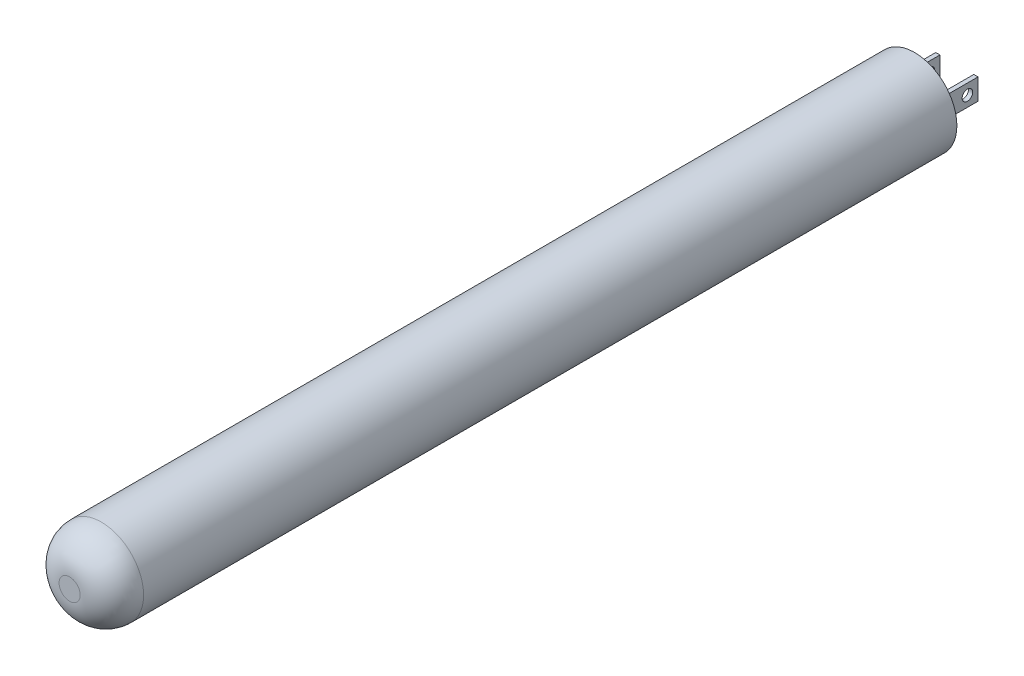
from build123d import *

# Parameters (mm, degrees)
SKETCH1_R           = 20
BOSS_EXTRUDE1_DEPTH = 200
FILLET2_R           = 15
BOSS_EXTRUDE2_START = -200
SKETCH2_W           = 2
SKETCH2_H           = 10
BOSS_EXTRUDE2_DEPTH = 20
SKETCH3_R           = 2.5
CUT_EXTRUDE1_DEPTH  = 11


with BuildPart() as part:
    # Sketch1 → Boss-Extrude1 (new, symmetric)
    with BuildSketch(Plane.XY):
        Circle(SKETCH1_R)
    extrude(amount=BOSS_EXTRUDE1_DEPTH, both=True)

    # Fillet2
    fillet2_edges = [part.edges().sort_by_distance(p)[0] for p in [
        (-20, 0, 200),
    ]]
    fillet(fillet2_edges, radius=FILLET2_R)

    # Sketch2 → Boss-Extrude2 (add)
    with BuildSketch(Plane.XY.offset(BOSS_EXTRUDE2_START)):
        with Locations((-9, 0)):
            Rectangle(SKETCH2_W, SKETCH2_H)
        with Locations((9, 0)):
            Rectangle(SKETCH2_W, SKETCH2_H)
    extrude(amount=-BOSS_EXTRUDE2_DEPTH)

    # Sketch3 → Cut-Extrude1 (cut, symmetric)
    with BuildSketch(Plane(origin=(0, 0, 0), x_dir=(0, 0, -1), z_dir=(1, 0, 0))):
        with Locations((215, 0)):
            Circle(SKETCH3_R)
    extrude(amount=CUT_EXTRUDE1_DEPTH, both=True, mode=Mode.SUBTRACT)


solid = part.part
